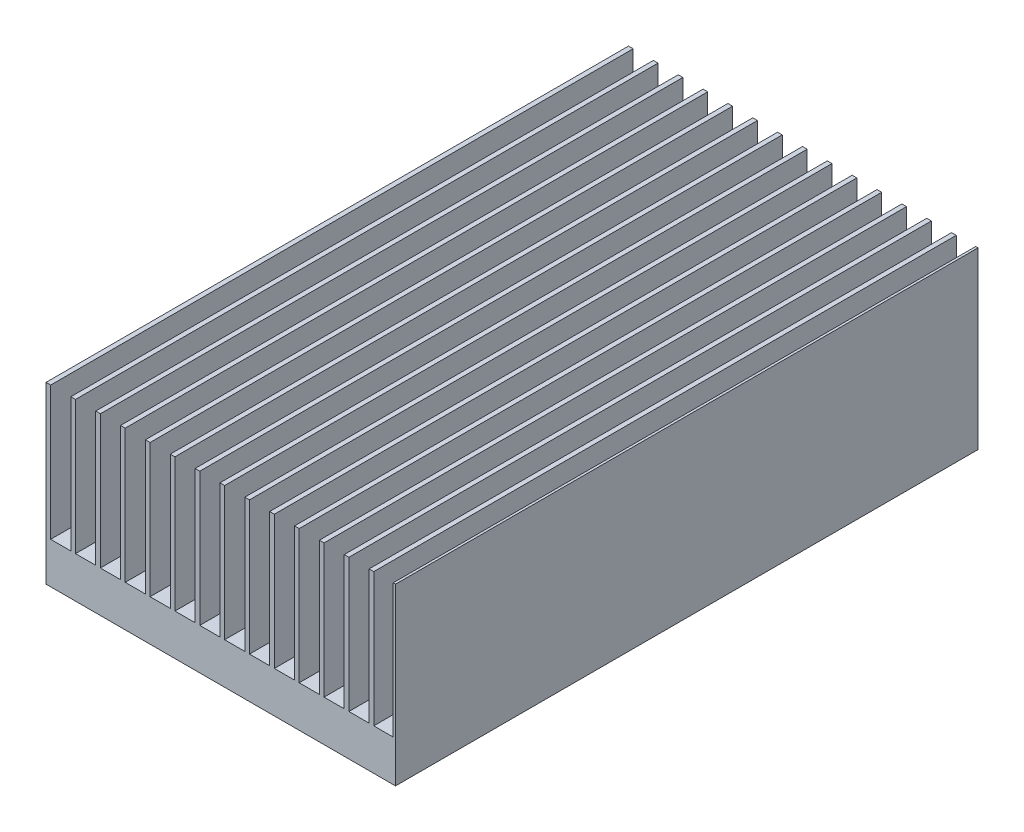
from build123d import *

# Parameters (mm, degrees)
BOSS_EXTRUDE1_DEPTH = 95.25
LPATTERN1_COUNT     = 2
LPATTERN1_PITCH     = 171.45
LPATTERN2_COUNT     = 2
LPATTERN2_PITCH     = 103.378


with BuildPart() as part:
    # Sketch1 → Boss-Extrude1 (new, symmetric)
    with BuildSketch(Plane.XY):
        Polygon((41.91, 6.731), (48.514, 6.731), (48.514, 50.419), (50.038, 50.419), (50.038, 6.731), (56.388, 6.731), (56.388, 50.419), (57.15, 50.419), (57.15, 6.731), (57.15, -6.731), (-57.15, -6.731), (-57.15, 6.731), (-57.15, 50.419), (-55.626, 50.419), (-55.626, 6.731), (-49.022, 6.731), (-49.022, 50.419), (-47.498, 50.419), (-47.498, 6.731), (-40.894, 6.731), (-40.894, 50.419), (-39.37, 50.419), (-39.37, 6.731), (-32.766, 6.731), (-32.766, 50.419), (-31.242, 50.419), (-31.242, 6.731), (-24.638, 6.731), (-24.638, 50.419), (-23.114, 50.419), (-23.114, 6.731), (-16.51, 6.731), (-16.51, 50.419), (-14.986, 50.419), (-14.986, 6.731), (-8.382, 6.731), (-8.382, 50.419), (-6.858, 50.419), (-6.858, 6.731), (-0.254, 6.731), (-0.254, 50.419), (1.27, 50.419), (1.27, 6.731), (7.874, 6.731), (7.874, 50.419), (9.398, 50.419), (9.398, 6.731), (16.002, 6.731), (16.002, 50.419), (17.526, 50.419), (17.526, 6.731), (24.13, 6.731), (24.13, 50.419), (25.654, 50.419), (25.654, 6.731), (32.258, 6.731), (32.258, 50.419), (33.782, 50.419), (33.782, 6.731), (40.386, 6.731), (40.386, 50.419), (41.91, 50.419), align=None)
    extrude(amount=BOSS_EXTRUDE1_DEPTH, both=True)

    # Sketch3 → #8-32 Tapped Hole1 (revolve, cut)
    with BuildSketch(Plane(origin=(47.625, -6.731, 85.725), x_dir=(0, 0, -1), z_dir=(1, 0, 0))):
        Polygon((0, 0), (0, 12.975806461), (1.7272, 11.938), (1.7272, 0), align=None)
    f_8_32_tapped_hole1 = revolve(axis=Axis((47.625, -13.081, 85.725), (0, 1, 0)), mode=Mode.SUBTRACT)

    # Sketch5 → #4-40 Tapped Hole1 (revolve, cut)
    with BuildSketch(Plane(origin=(38.989, -6.731, 25.908), x_dir=(0, 0, -1), z_dir=(1, 0, 0))):
        Polygon((0, 0), (0, 11.855152758), (1.1303, 11.176), (1.1303, 0), align=None)
    f_4_40_tapped_hole1 = revolve(axis=Axis((38.989, -13.081, 25.908), (0, 1, 0)), mode=Mode.SUBTRACT)

    # LPattern1: #8-32 Tapped Hole1 ×2
    with Locations(*[(0, 0, -i * LPATTERN1_PITCH) for i in range(1, LPATTERN1_COUNT)]):
        add(f_8_32_tapped_hole1, mode=Mode.SUBTRACT)

    # LPattern2: #4-40 Tapped Hole1 ×2
    with Locations(*[(0, 0, -i * LPATTERN2_PITCH) for i in range(1, LPATTERN2_COUNT)]):
        add(f_4_40_tapped_hole1, mode=Mode.SUBTRACT)

    # Mirror1: #8-32 Tapped Hole1, #4-40 Tapped Hole1 across plane
    add(f_8_32_tapped_hole1.mirror(Plane(origin=(0, 0, 0), x_dir=(0, 0, 1), z_dir=(1, 0, 0))), mode=Mode.SUBTRACT)
    add(f_4_40_tapped_hole1.mirror(Plane(origin=(0, 0, 0), x_dir=(0, 0, 1), z_dir=(1, 0, 0))), mode=Mode.SUBTRACT)

    # Mirror1 copy 1 sketch → Mirror1 copy 1 (revolve, cut)
    with BuildSketch(Plane(origin=(-47.625, -6.731, -85.725), x_dir=(0, 0, -1), z_dir=(-1, 0, 0))):
        Polygon((0, 0), (0, -12.975806461), (1.7272, -11.938), (1.7272, 0), align=None)
    revolve(axis=Axis((-47.625, -13.081, -85.725), (0, -1, 0)), mode=Mode.SUBTRACT)

    # Mirror1 copy 2 sketch → Mirror1 copy 2 (revolve, cut)
    with BuildSketch(Plane(origin=(-38.989, -6.731, -77.47), x_dir=(0, 0, -1), z_dir=(-1, 0, 0))):
        Polygon((0, 0), (0, -11.855152758), (1.1303, -11.176), (1.1303, 0), align=None)
    revolve(axis=Axis((-38.989, -13.081, -77.47), (0, -1, 0)), mode=Mode.SUBTRACT)


solid = part.part
